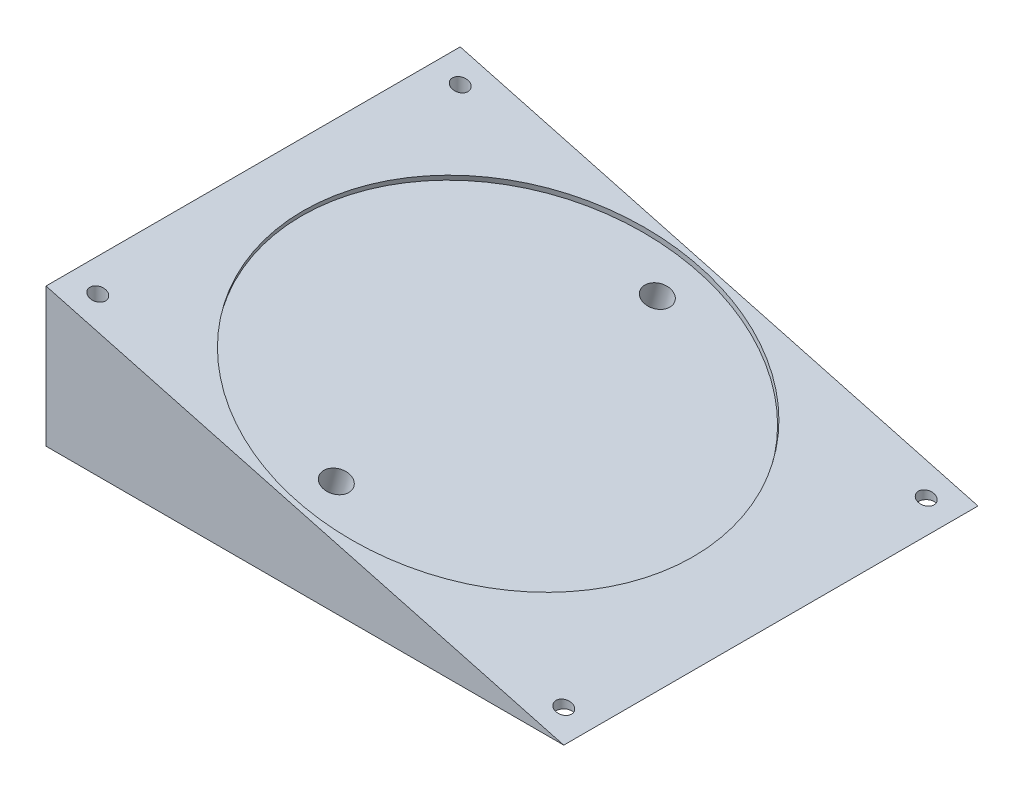
from build123d import *

# Parameters (mm, degrees)
SALIENTE_EXTRUIR1_DEPTH = 80
CROQUIS2_R              = 39
CORTAR_EXTRUIR1_DEPTH   = 1
CROQUIS3_R              = 2.5
CORTAR_EXTRUIR2_DEPTH   = 6
CROQUIS5_R              = 1.5
CORTAR_EXTRUIR3_DEPTH   = 40


with BuildPart() as part:
    # Croquis1 → Saliente-Extruir1 (new body)
    with BuildSketch(Plane.XY):
        Polygon((-50, 0), (50, 0), (-50, 26.794919243), align=None)
    extrude(amount=SALIENTE_EXTRUIR1_DEPTH)

    # Croquis2 → Cortar-Extruir1 (cut)
    with BuildSketch(Plane(origin=(3.349364905, 12.5, 0), x_dir=(0.96592582628907, -0.2588190451025143, 0), z_dir=(0.2588190451025143, 0.96592582628907, 0))):
        with Locations(Location((-6.231326727, -40, 0), (0, 0, 180))):
            Circle(CROQUIS2_R)
    extrude(amount=-CORTAR_EXTRUIR1_DEPTH, mode=Mode.SUBTRACT)

    # Croquis3 → Cortar-Extruir2 (cut)
    with BuildSketch(Plane(origin=(3.09054586, 11.534074174, 0), x_dir=(0.96592582628907, -0.2588190451025143, 0), z_dir=(0.2588190451025143, 0.96592582628907, 0))):
        with Locations(Location((-6.231326727, -9, 0), (0, 0, 180))):
            Circle(CROQUIS3_R)
        with Locations(Location((-6.231326727, -71, 0), (0, 0, 180))):
            Circle(CROQUIS3_R)
    extrude(amount=-CORTAR_EXTRUIR2_DEPTH, mode=Mode.SUBTRACT)

    # Croquis5 → Cortar-Extruir3 (cut)
    with BuildSketch(Plane.XZ):
        with Locations(Location((-45, 75, 0), (0, 0, 270))):
            Circle(CROQUIS5_R)
        with Locations((45, 75)):
            Circle(CROQUIS5_R)
        with Locations(Location((45, 5, 0), (0, 0, 270))):
            Circle(CROQUIS5_R)
        with Locations((-45, 5)):
            Circle(CROQUIS5_R)
    extrude(amount=-CORTAR_EXTRUIR3_DEPTH, mode=Mode.SUBTRACT)


solid = part.part
